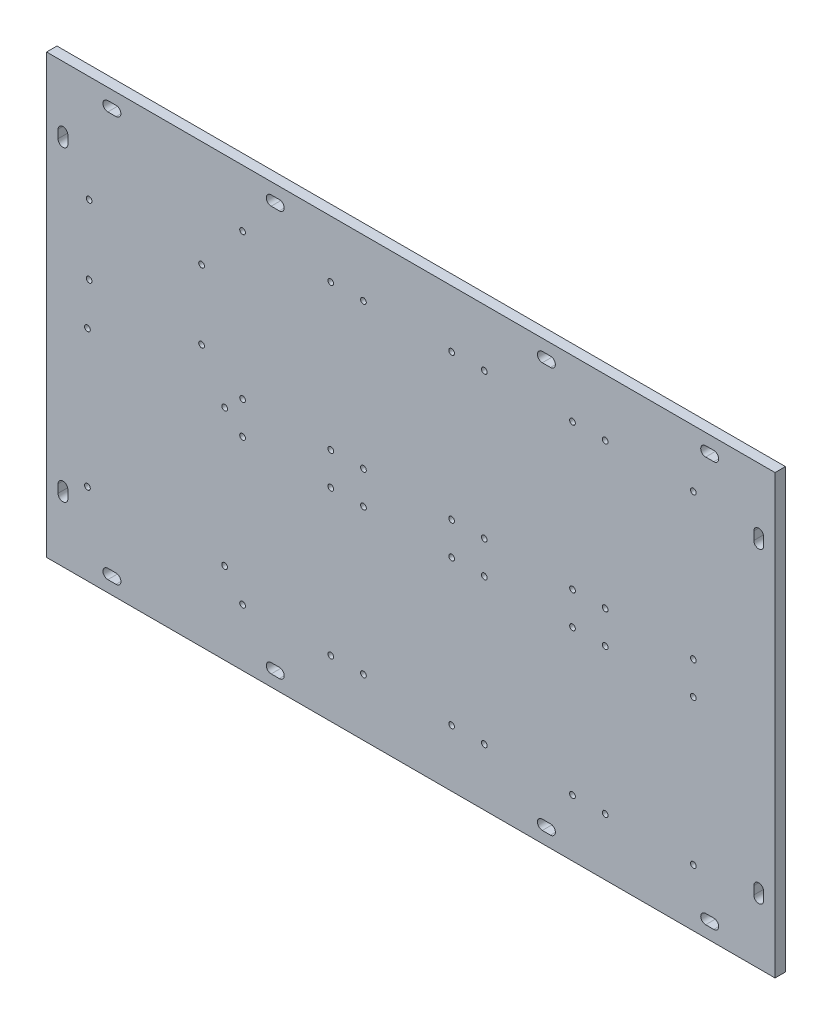
from build123d import *

# Parameters (mm, degrees)
SKETCH1_W           = 446
SKETCH1_H           = 268
BOSS_EXTRUDE1_DEPTH = 6.35
SKETCH3_R           = 1.75
CUT_EXTRUDE1_DEPTH  = 261.240893212


with BuildPart() as part:
    # Sketch1 → Boss-Extrude1 (new body)
    with BuildSketch(Plane.XY):
        Rectangle(SKETCH1_W, SKETCH1_H)
    extrude(amount=BOSS_EXTRUDE1_DEPTH)

    # Sketch3 → Cut-Extrude1 (cut, through all)
    with BuildSketch(Plane.XY.offset(6.35)):
        with Locations((119, 10)):
            Circle(SKETCH3_R)
        with Locations((173, 10)):
            Circle(SKETCH3_R)
        with Locations((119, 99)):
            Circle(SKETCH3_R)
        with Locations((173, 99)):
            Circle(SKETCH3_R)
        with Locations((99, 99)):
            Circle(SKETCH3_R)
        with Locations((99, 10)):
            Circle(SKETCH3_R)
        with Locations((45, 10)):
            Circle(SKETCH3_R)
        with Locations((45, 99)):
            Circle(SKETCH3_R)
        with Locations((25, 99)):
            Circle(SKETCH3_R)
        with Locations((25, 10)):
            Circle(SKETCH3_R)
        with Locations((-29, 10)):
            Circle(SKETCH3_R)
        with Locations((-29, 99)):
            Circle(SKETCH3_R)
        with Locations((-49, 99)):
            Circle(SKETCH3_R)
        with Locations((-49, 10)):
            Circle(SKETCH3_R)
        with Locations((-103, 10)):
            Circle(SKETCH3_R)
        with Locations((-103, 99)):
            Circle(SKETCH3_R)
        with Locations(Location((-103, -99, 0), (0, 0, 180))):
            Circle(SKETCH3_R)
        with Locations(Location((-103, -10, 0), (0, 0, 180))):
            Circle(SKETCH3_R)
        with Locations(Location((-49, -10, 0), (0, 0, 180))):
            Circle(SKETCH3_R)
        with Locations(Location((-49, -99, 0), (0, 0, 180))):
            Circle(SKETCH3_R)
        with Locations(Location((-29, -99, 0), (0, 0, 180))):
            Circle(SKETCH3_R)
        with Locations(Location((-29, -10, 0), (0, 0, 180))):
            Circle(SKETCH3_R)
        with Locations(Location((25, -10, 0), (0, 0, 180))):
            Circle(SKETCH3_R)
        with Locations(Location((25, -99, 0), (0, 0, 180))):
            Circle(SKETCH3_R)
        with Locations(Location((45, -99, 0), (0, 0, 180))):
            Circle(SKETCH3_R)
        with Locations(Location((45, -10, 0), (0, 0, 180))):
            Circle(SKETCH3_R)
        with Locations(Location((99, -10, 0), (0, 0, 180))):
            Circle(SKETCH3_R)
        with Locations(Location((99, -99, 0), (0, 0, 180))):
            Circle(SKETCH3_R)
        with Locations(Location((173, -99, 0), (0, 0, 180))):
            Circle(SKETCH3_R)
        with Locations(Location((119, -99, 0), (0, 0, 180))):
            Circle(SKETCH3_R)
        with Locations(Location((173, -10, 0), (0, 0, 180))):
            Circle(SKETCH3_R)
        with Locations(Location((119, -10, 0), (0, 0, 180))):
            Circle(SKETCH3_R)
        with Locations((-198, 0)):
            Circle(SKETCH3_R)
        with Locations((-114, 0)):
            Circle(SKETCH3_R)
        with Locations((-198, -84)):
            Circle(SKETCH3_R)
        with Locations((-114, -84)):
            Circle(SKETCH3_R)
        with Locations((-196.93, 26.3)):
            Circle(SKETCH3_R)
        with Locations((-128.1, 26.3)):
            Circle(SKETCH3_R)
        with Locations((-128.1, 68.72)):
            Circle(SKETCH3_R)
        with Locations((-196.93, 68.72)):
            Circle(SKETCH3_R)
        with BuildLine():
            Line((-185.5, 127), (-180.5, 127))
            ThreePointArc((-180.5, 127), (-177.5, 124), (-180.5, 121))
            Line((-180.5, 121), (-185.5, 121))
            ThreePointArc((-185.5, 121), (-188.5, 124), (-185.5, 127))
        make_face()
        with BuildLine():
            Line((-210, 96.5), (-210, 91.5))
            ThreePointArc((-210, 91.5), (-213, 88.5), (-216, 91.5))
            Line((-216, 91.5), (-216, 96.5))
            ThreePointArc((-216, 96.5), (-213, 99.5), (-210, 96.5))
        make_face()
        with BuildLine():
            Line((-85.5, 127), (-80.5, 127))
            ThreePointArc((-80.5, 127), (-77.5, 124), (-80.5, 121))
            Line((-80.5, 121), (-85.5, 121))
            ThreePointArc((-85.5, 121), (-88.5, 124), (-85.5, 127))
        make_face()
        with BuildLine():
            Line((85.5, 127), (80.5, 127))
            ThreePointArc((80.5, 127), (77.5, 124), (80.5, 121))
            Line((80.5, 121), (85.5, 121))
            ThreePointArc((85.5, 121), (88.5, 124), (85.5, 127))
        make_face()
        with BuildLine():
            Line((185.5, 127), (180.5, 127))
            ThreePointArc((180.5, 127), (177.5, 124), (180.5, 121))
            Line((180.5, 121), (185.5, 121))
            ThreePointArc((185.5, 121), (188.5, 124), (185.5, 127))
        make_face()
        with BuildLine():
            Line((210, 96.5), (210, 91.5))
            ThreePointArc((210, 91.5), (213, 88.5), (216, 91.5))
            Line((216, 91.5), (216, 96.5))
            ThreePointArc((216, 96.5), (213, 99.5), (210, 96.5))
        make_face()
        with BuildLine():
            Line((210, -96.5), (210, -91.5))
            ThreePointArc((210, -91.5), (213, -88.5), (216, -91.5))
            Line((216, -91.5), (216, -96.5))
            ThreePointArc((216, -96.5), (213, -99.5), (210, -96.5))
        make_face()
        with BuildLine():
            Line((185.5, -127), (180.5, -127))
            ThreePointArc((180.5, -127), (177.5, -124), (180.5, -121))
            Line((180.5, -121), (185.5, -121))
            ThreePointArc((185.5, -121), (188.5, -124), (185.5, -127))
        make_face()
        with BuildLine():
            Line((85.5, -127), (80.5, -127))
            ThreePointArc((80.5, -127), (77.5, -124), (80.5, -121))
            Line((80.5, -121), (85.5, -121))
            ThreePointArc((85.5, -121), (88.5, -124), (85.5, -127))
        make_face()
        with BuildLine():
            Line((-85.5, -127), (-80.5, -127))
            ThreePointArc((-80.5, -127), (-77.5, -124), (-80.5, -121))
            Line((-80.5, -121), (-85.5, -121))
            ThreePointArc((-85.5, -121), (-88.5, -124), (-85.5, -127))
        make_face()
        with BuildLine():
            Line((-185.5, -127), (-180.5, -127))
            ThreePointArc((-180.5, -127), (-177.5, -124), (-180.5, -121))
            Line((-180.5, -121), (-185.5, -121))
            ThreePointArc((-185.5, -121), (-188.5, -124), (-185.5, -127))
        make_face()
        with BuildLine():
            Line((-210, -96.5), (-210, -91.5))
            ThreePointArc((-210, -91.5), (-213, -88.5), (-216, -91.5))
            Line((-216, -91.5), (-216, -96.5))
            ThreePointArc((-216, -96.5), (-213, -99.5), (-210, -96.5))
        make_face()
    extrude(amount=-CUT_EXTRUDE1_DEPTH, mode=Mode.SUBTRACT)


solid = part.part
